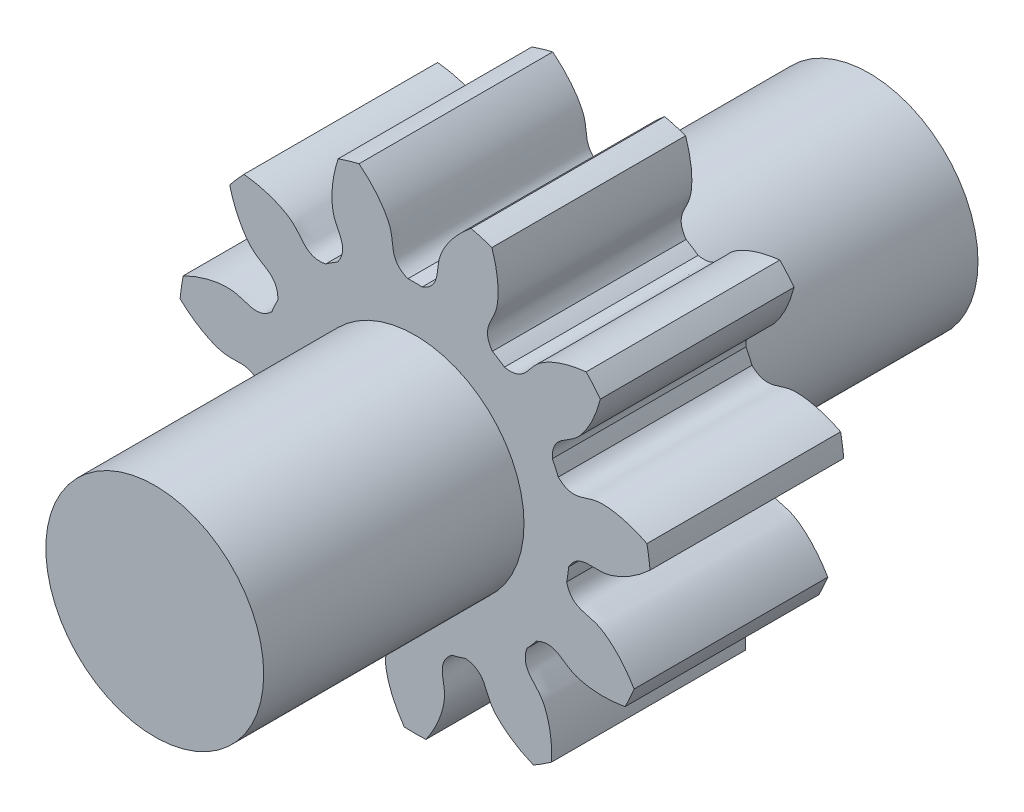
from build123d import *

# Parameters (mm, degrees)
SKETCH_1_R               = 19.5
EXTRUDE_1_DEPTH          = 16
CUT_EXTRUDE_1_DEPTH      = 32.882597134
PATTERN_CIRCULAR_1_COUNT = 11
SKETCH_4_R               = 9
EXTRUDE_2_DEPTH          = 21.5
EXTRUDE_START            = -59
SKETCH_5_R               = 9
EXTRUDE_3_DEPTH          = 59


with BuildPart() as part:
    # 草图1 → 凸台-拉伸1 (new body)
    with BuildSketch(Plane.XY):
        Circle(SKETCH_1_R)
    extrude(amount=EXTRUDE_1_DEPTH)

    # 草图2 → 切除-拉伸1 (cut, through all)
    with BuildSketch(Plane.XY):
        with BuildLine():
            ThreePointArc((0.590199137, 12.736332478), (0, 12.75), (-0.590199137, 12.736332478))
            add(Edge.make_bspline(
                [(-0.590199137, 12.736332478), (-2.104399768, 13.33978101), (-1.723823723, 14.574007296), (-2.047209403, 15.622609504), (-2.06567998, 15.678560835), (-2.087328564, 15.739981399), (-2.112375475, 15.806765195), (-2.141044558, 15.878798214), (-2.173554396, 15.955960086), (-2.210120775, 16.038123689), (-2.250955702, 16.125155377), (-2.296267473, 16.216915037), (-2.346260425, 16.313256193), (-2.401134788, 16.414026111), (-2.461086511, 16.519065906), (-2.526307097, 16.628210646), (-2.59698344, 16.741289477), (-2.673297666, 16.858125736), (-2.755426976, 16.978537076), (-2.84354349, 17.10233559), (-2.937814098, 17.22932795), (-3.038400313, 17.359315532), (-3.145458125, 17.492094564), (-3.25913786, 17.627456259), (-3.379584045, 17.765186968), (-3.506935271, 17.905068328), (-3.641324065, 18.04687741), (-3.782876764, 18.190386879), (-3.931713391, 18.335365155), (-4.087947537, 18.48157657), (-4.251686244, 18.628781537), (-4.4230299, 18.776736718), (-4.602072127, 18.925195192), (-4.788899681, 19.073906635), (-4.983592353, 19.22261749), (-5.186222877, 19.37107115), (-5.396856841, 19.519008138), (-5.615552596, 19.666166291), (-5.842361186, 19.812280946), (-6.077326263, 19.95708513), (-6.320484019, 20.100309746), (-6.571863123, 20.24168377), (-6.831484652, 20.380934442), (-7.099362041, 20.517787461), (-7.375501026, 20.651967184), (-7.659899599, 20.783196825), (-7.952547963, 20.911198652), (-8.253428497, 21.035694193), (-8.562515723, 21.156404431), (-8.879776275, 21.273050015), (-9.20516888, 21.385351461), (-9.538644346, 21.493029354), (-9.880145505, 21.595804562), (-10.350077156, 21.727041879), (-10.70840738, 21.815522124), (-10.950374418, 21.870245247)],
                knots=[0, 0, 0, 0, 0.219011067, 0.222641587, 0.226699227, 0.231183987, 0.236095867, 0.241434867, 0.247200988, 0.253394228, 0.260014588, 0.267062068, 0.274536668, 0.282438388, 0.290767228, 0.299523189, 0.308706269, 0.318316469, 0.328353789, 0.338818229, 0.34970979, 0.36102847, 0.37277427, 0.38494719, 0.39754723, 0.410574391, 0.424028671, 0.437910071, 0.452218591, 0.466954232, 0.482116992, 0.497706872, 0.513723872, 0.530167993, 0.547039233, 0.564337593, 0.582063073, 0.600215674, 0.618795394, 0.637802234, 0.657236195, 0.677097275, 0.697385475, 0.718100796, 0.739243236, 0.760812796, 0.782809477, 0.805233277, 0.828084197, 0.851362238, 0.875067398, 0.899199678, 0.923759079, 0.948745599, 1, 1, 1, 1], degree=3))
            ThreePointArc((-10.950374418, 21.870245247), (0, 24.458502143), (10.950374418, 21.870245247))
            add(Edge.make_bspline(
                [(0.590199137, 12.736332478), (2.104399768, 13.33978101), (1.723823723, 14.574007296), (2.047209403, 15.622609504), (2.06567998, 15.678560835), (2.087328564, 15.739981399), (2.112375475, 15.806765195), (2.141044558, 15.878798214), (2.173554396, 15.955960086), (2.210120775, 16.038123689), (2.250955702, 16.125155377), (2.296267473, 16.216915037), (2.346260425, 16.313256193), (2.401134788, 16.414026111), (2.461086511, 16.519065906), (2.526307097, 16.628210646), (2.59698344, 16.741289477), (2.673297666, 16.858125736), (2.755426976, 16.978537076), (2.84354349, 17.10233559), (2.937814098, 17.22932795), (3.038400313, 17.359315532), (3.145458125, 17.492094564), (3.25913786, 17.627456259), (3.379584045, 17.765186968), (3.506935271, 17.905068328), (3.641324065, 18.04687741), (3.782876764, 18.190386879), (3.931713391, 18.335365155), (4.087947537, 18.48157657), (4.251686244, 18.628781537), (4.4230299, 18.776736718), (4.602072127, 18.925195192), (4.788899681, 19.073906635), (4.983592353, 19.22261749), (5.186222877, 19.37107115), (5.396856841, 19.519008138), (5.615552596, 19.666166291), (5.842361186, 19.812280946), (6.077326263, 19.95708513), (6.320484019, 20.100309746), (6.571863123, 20.24168377), (6.831484652, 20.380934442), (7.099362041, 20.517787461), (7.375501026, 20.651967184), (7.659899599, 20.783196825), (7.952547963, 20.911198652), (8.253428497, 21.035694193), (8.562515723, 21.156404431), (8.879776275, 21.273050015), (9.20516888, 21.385351461), (9.538644346, 21.493029354), (9.880145505, 21.595804562), (10.350077156, 21.727041879), (10.70840738, 21.815522124), (10.950374418, 21.870245247)],
                knots=[0, 0, 0, 0, 0.219011067, 0.222641587, 0.226699227, 0.231183987, 0.236095867, 0.241434867, 0.247200988, 0.253394228, 0.260014588, 0.267062068, 0.274536668, 0.282438388, 0.290767228, 0.299523189, 0.308706269, 0.318316469, 0.328353789, 0.338818229, 0.34970979, 0.36102847, 0.37277427, 0.38494719, 0.39754723, 0.410574391, 0.424028671, 0.437910071, 0.452218591, 0.466954232, 0.482116992, 0.497706872, 0.513723872, 0.530167993, 0.547039233, 0.564337593, 0.582063073, 0.600215674, 0.618795394, 0.637802234, 0.657236195, 0.677097275, 0.697385475, 0.718100796, 0.739243236, 0.760812796, 0.782809477, 0.805233277, 0.828084197, 0.851362238, 0.875067398, 0.899199678, 0.923759079, 0.948745599, 1, 1, 1, 1], degree=3))
        make_face()
    cut_extrude_1 = extrude(amount=CUT_EXTRUDE_1_DEPTH, mode=Mode.SUBTRACT)

    # 阵列(圆周)1: 切除-拉伸1 ×11 about axis
    pattern_circular_1_axis = Axis((0, 0, -0.8), (0, 0, 1))
    for i in range(1, PATTERN_CIRCULAR_1_COUNT):
        add(cut_extrude_1.rotate(pattern_circular_1_axis, i * 360 / PATTERN_CIRCULAR_1_COUNT), mode=Mode.SUBTRACT)

    # 草图4 → 凸台-拉伸2 (add)
    with BuildSketch(Plane.XY.offset(16)):
        Circle(SKETCH_4_R)
    extrude(amount=EXTRUDE_2_DEPTH)

    # 草图5 → 凸台-拉伸3 (add)
    with BuildSketch(Plane.XY.offset(37.5).offset(EXTRUDE_START)):
        Circle(SKETCH_5_R)
    extrude(amount=EXTRUDE_3_DEPTH)


solid = part.part
